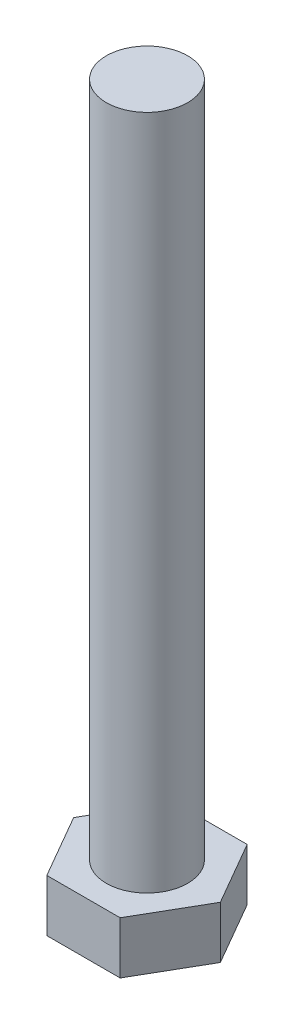
from build123d import *

# Parameters (mm, degrees)
BOSS_EXTRUDE1_DEPTH = 7.7
SKETCH2_R           = 6
BOSS_EXTRUDE2_DEPTH = 99.8


with BuildPart() as part:
    # Sketch1 → Boss-Extrude1 (new body)
    with BuildSketch(Plane(origin=(0, 0, 0), x_dir=(1, 0, 0), z_dir=(0, 1, 0))):
        Polygon((-10.825317547, 0), (-5.412658774, -9.375), (5.412658774, -9.375), (10.825317547, 0), (5.412658774, 9.375), (-5.412658774, 9.375), align=None)
    extrude(amount=BOSS_EXTRUDE1_DEPTH)

    # Sketch2 → Boss-Extrude2 (add)
    with BuildSketch(Plane(origin=(0, 7.7, 0), x_dir=(1, 0, 0), z_dir=(0, 1, 0))):
        with Locations(Location((0, 0, 0), (0, 0, 270))):
            Circle(SKETCH2_R)
    extrude(amount=BOSS_EXTRUDE2_DEPTH)


solid = part.part
